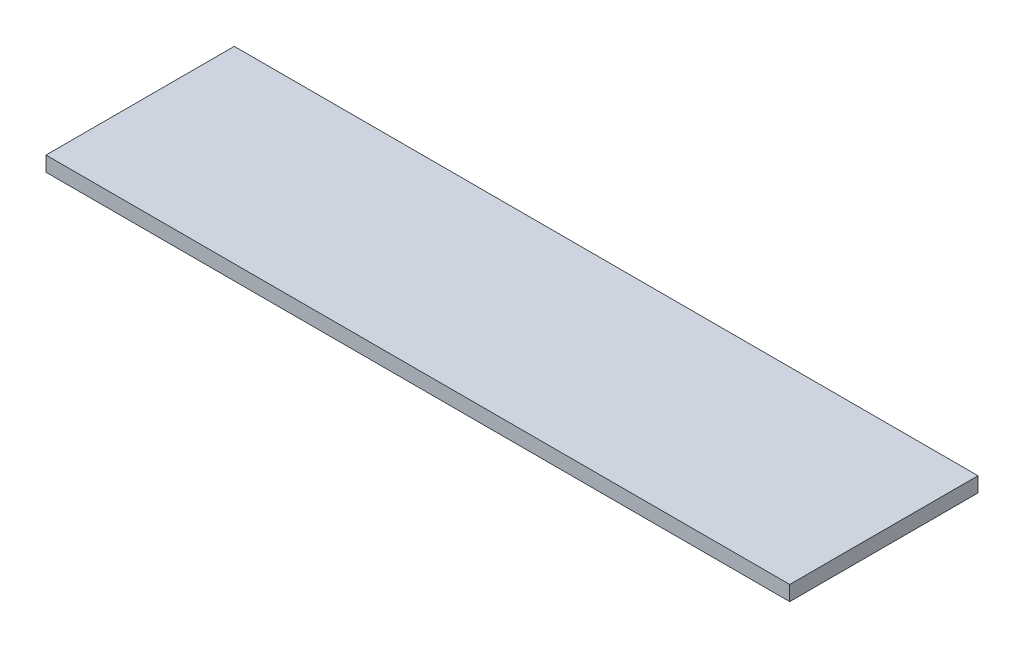
from build123d import *

# Parameters (mm, degrees)
EXTRUDE_1_DEPTH = 6


with BuildPart() as part:
    # Эскиз1 → Бобышка-Вытянуть1 (new body)
    with BuildSketch(Plane(origin=(0, 0, 0), x_dir=(1, 0, 0), z_dir=(0, 1, 0))):
        Polygon((-149.509985433, -37.850701628), (149.509985433, -37.850701628), (149.509985433, 37.850701628), (7.68793205, 37.850701628), (-82.803443462, 37.850701628), (-149.509985433, 37.850701628), align=None)
    extrude(amount=EXTRUDE_1_DEPTH)


solid = part.part
